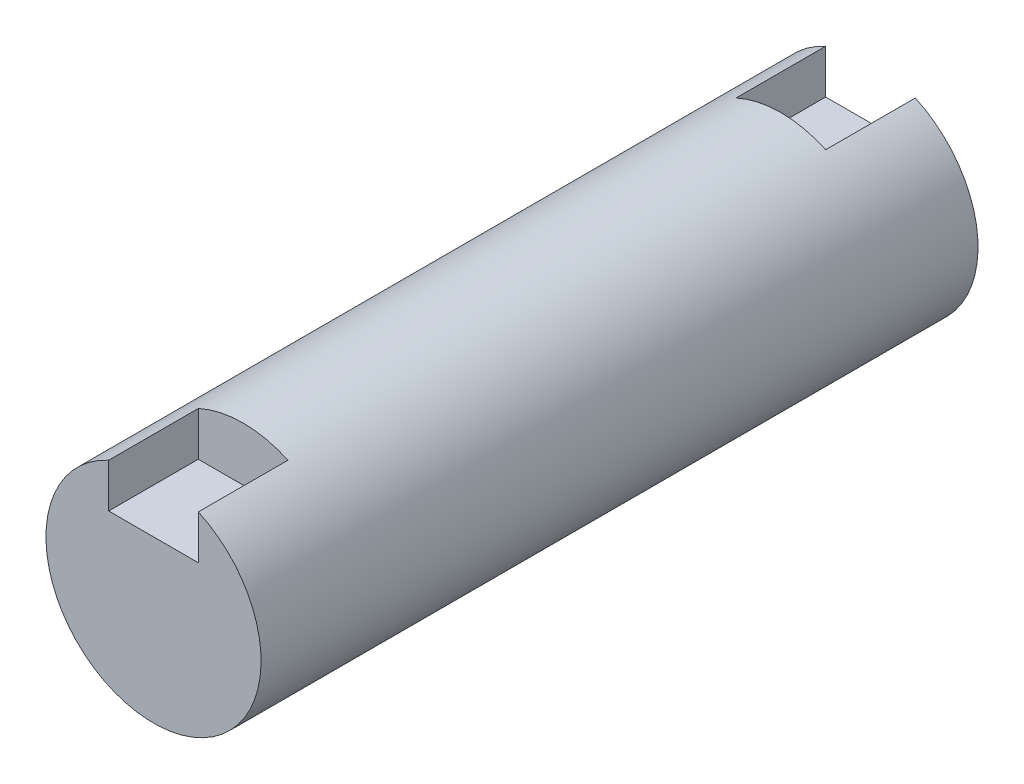
from build123d import *

# Parameters (mm, degrees)
SKETCH_1_R          = 6
EXTRUDE_1_DEPTH     = 40
CUT_EXTRUDE_START   = -5
CUT_EXTRUDE_1_DEPTH = 5
CUT_EXTRUDE_2_DEPTH = 5


with BuildPart() as part:
    # 草图1 → 凸台-拉伸1 (new body)
    with BuildSketch(Plane.XY):
        Circle(SKETCH_1_R)
    extrude(amount=EXTRUDE_1_DEPTH)

    # 草图2 → 切除-拉伸1 (cut)
    with BuildSketch(Plane.XY.offset(40).offset(CUT_EXTRUDE_START)):
        with BuildLine():
            Line((2.5, 3), (-2.5, 3))
            Line((-2.5, 3), (-2.5, 5.454356057))
            ThreePointArc((-2.5, 5.454356057), (0, 6), (2.5, 5.454356057))
            Line((2.5, 5.454356057), (2.5, 3))
        make_face()
    extrude(amount=CUT_EXTRUDE_1_DEPTH, mode=Mode.SUBTRACT)

    # 草图3 → 切除-拉伸2 (cut)
    with BuildSketch(Plane(origin=(0, 0, 0), x_dir=(-1, 0, 0), z_dir=(0, 0, -1))):
        with BuildLine():
            Line((2.5, 3), (-2.5, 3))
            Line((-2.5, 3), (-2.5, 5.454356057))
            ThreePointArc((-2.5, 5.454356057), (0, 6), (2.5, 5.454356057))
            Line((2.5, 5.454356057), (2.5, 3))
        make_face()
    extrude(amount=-CUT_EXTRUDE_2_DEPTH, mode=Mode.SUBTRACT)


solid = part.part
